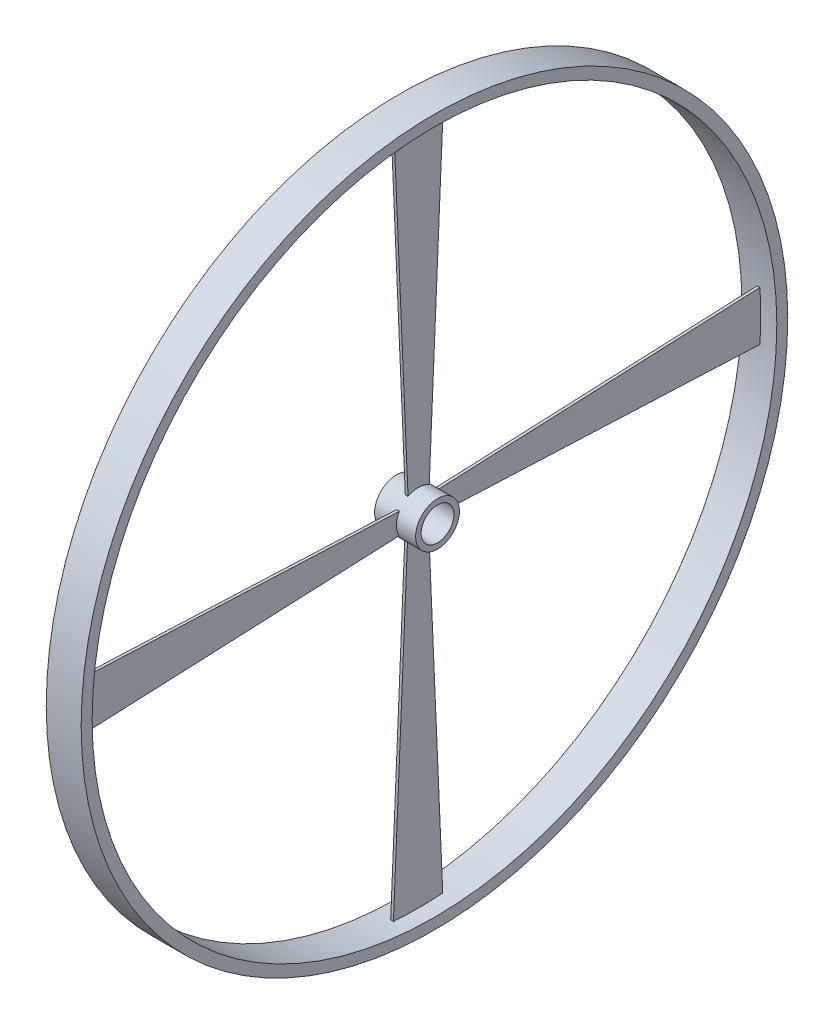
from build123d import *

# Parameters (mm, degrees)
SKETCH1_R           = 129
SKETCH1_R_2         = 125
BOSS_EXTRUDE1_DEPTH = 6.375
BOSS_EXTRUDE2_DEPTH = 0.5
SKETCH2_4_R         = 6
BOSS_EXTRUDE3_DEPTH = 7.5


with BuildPart() as part:
    # Sketch1 → Boss-Extrude1 (new, symmetric)
    with BuildSketch(Plane(origin=(0, 0, 0), x_dir=(0, 0, -1), z_dir=(1, 0, 0))):
        Circle(SKETCH1_R)
        Circle(SKETCH1_R_2, mode=Mode.SUBTRACT)
    extrude(amount=BOSS_EXTRUDE1_DEPTH, both=True)

    # Sketch2 → Boss-Extrude2 (add, symmetric)
    with BuildSketch(Plane(origin=(0, 0, 0), x_dir=(0, 0, -1), z_dir=(1, 0, 0))):
        with BuildLine():
            ThreePointArc((-3.768738548, 7.056671294), (0.113394951, 7.999196309), (3.9672518, 6.947007496))
            Line((3.9672518, 6.947007496), (9.107052817, 124.667804942))
            ThreePointArc((9.107052817, 124.667804942), (0.101595075, 124.999958714), (-8.904390692, 124.682443938))
            Line((-8.904390692, 124.682443938), (-3.768738548, 7.056671294))
        make_face()
        with BuildLine():
            Line((124.682443938, 8.904390692), (7.056671294, 3.768738548))
            ThreePointArc((7.056671294, 3.768738548), (7.999196309, -0.113394951), (6.947007496, -3.9672518))
            Line((6.947007496, -3.9672518), (124.667804942, -9.107052817))
            ThreePointArc((124.667804942, -9.107052817), (124.999958714, -0.101595075), (124.682443938, 8.904390692))
        make_face()
        with BuildLine():
            ThreePointArc((-7.056671294, -3.768738548), (-7.999196309, 0.113394951), (-6.947007496, 3.9672518))
            Line((-6.947007496, 3.9672518), (-124.667804942, 9.107052817))
            ThreePointArc((-124.667804942, 9.107052817), (-124.999958714, 0.101595075), (-124.682443938, -8.904390692))
            Line((-124.682443938, -8.904390692), (-7.056671294, -3.768738548))
        make_face()
        with BuildLine():
            Line((8.904390692, -124.682443938), (3.768738548, -7.056671294))
            ThreePointArc((3.768738548, -7.056671294), (-0.113394951, -7.999196309), (-3.9672518, -6.947007496))
            Line((-3.9672518, -6.947007496), (-9.107052817, -124.667804942))
            ThreePointArc((-9.107052817, -124.667804942), (-0.101595075, -124.999958714), (8.904390692, -124.682443938))
        make_face()
    extrude(amount=BOSS_EXTRUDE2_DEPTH, both=True)

    # Sketch2<4> → Boss-Extrude3 (add, symmetric)
    with BuildSketch(Plane(origin=(0, 0, 0), x_dir=(0, 0, -1), z_dir=(1, 0, 0))):
        with BuildLine():
            ThreePointArc((7.056671294, 3.768738548), (5.736468293, 5.576103615), (3.9672518, 6.947007496))
            ThreePointArc((3.9672518, 6.947007496), (0.113394951, 7.999196309), (-3.768738548, 7.056671294))
            ThreePointArc((-3.768738548, 7.056671294), (-5.576103615, 5.736468293), (-6.947007496, 3.9672518))
            ThreePointArc((-6.947007496, 3.9672518), (-7.999196309, 0.113394951), (-7.056671294, -3.768738548))
            ThreePointArc((-7.056671294, -3.768738548), (-5.736468293, -5.576103615), (-3.9672518, -6.947007496))
            ThreePointArc((-3.9672518, -6.947007496), (-0.113394951, -7.999196309), (3.768738548, -7.056671294))
            ThreePointArc((3.768738548, -7.056671294), (5.576103615, -5.736468293), (6.947007496, -3.9672518))
            ThreePointArc((6.947007496, -3.9672518), (7.732271981, -2.05230846), (8, 0))
            ThreePointArc((8, 0), (7.760585363, 1.942502207), (7.056671294, 3.768738548))
        make_face()
        Circle(SKETCH2_4_R, mode=Mode.SUBTRACT)
    extrude(amount=BOSS_EXTRUDE3_DEPTH, both=True)


solid = part.part
